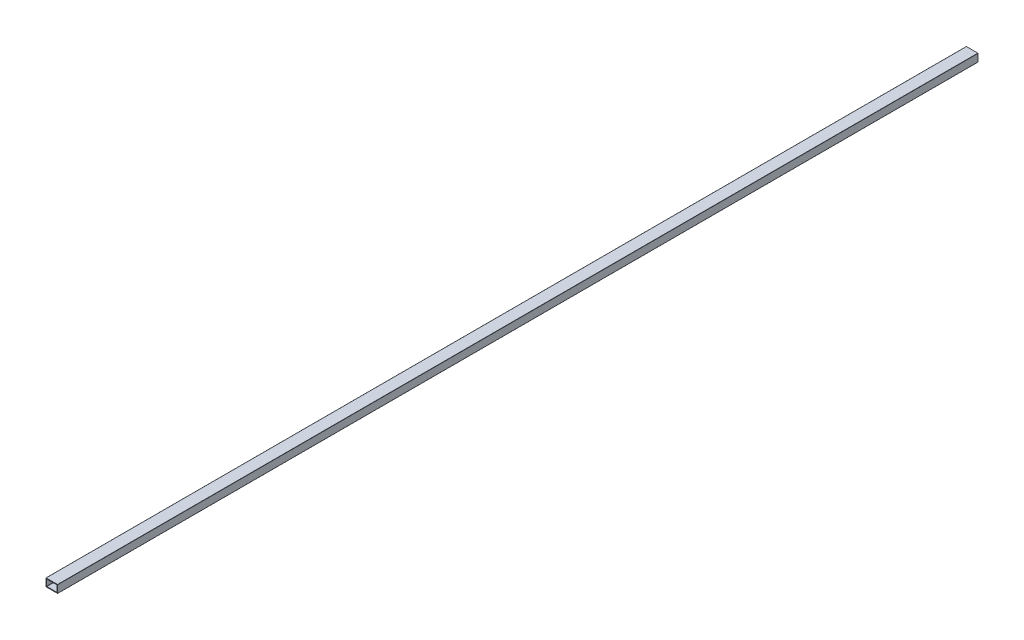
from build123d import *

# Parameters (mm, degrees)
CROQUIS1_W              = 76.2
CROQUIS1_H              = 50.8
CROQUIS1_W_2            = 67.1
CROQUIS1_H_2            = 41.7
SALIENTE_EXTRUIR1_DEPTH = 6000
REDONDEO1_R             = 1


with BuildPart() as part:
    # Croquis1 → Saliente-Extruir1 (new body)
    with BuildSketch(Plane.XY):
        Rectangle(CROQUIS1_W, CROQUIS1_H)
        Rectangle(CROQUIS1_W_2, CROQUIS1_H_2, mode=Mode.SUBTRACT)
    extrude(amount=-SALIENTE_EXTRUIR1_DEPTH)

    # Redondeo1
    redondeo1_edges = [part.edges().sort_by_distance(p)[0] for p in [
        (33.55, -20.85, -3000),
        (-33.55, -20.85, -3000),
        (-33.55, 20.85, -3000),
        (33.55, 20.85, -3000),
        (38.1, -25.4, -3000),
        (-38.1, -25.4, -3000),
        (-38.1, 25.4, -3000),
        (38.1, 25.4, -3000),
    ]]
    fillet(redondeo1_edges, radius=REDONDEO1_R)


solid = part.part
